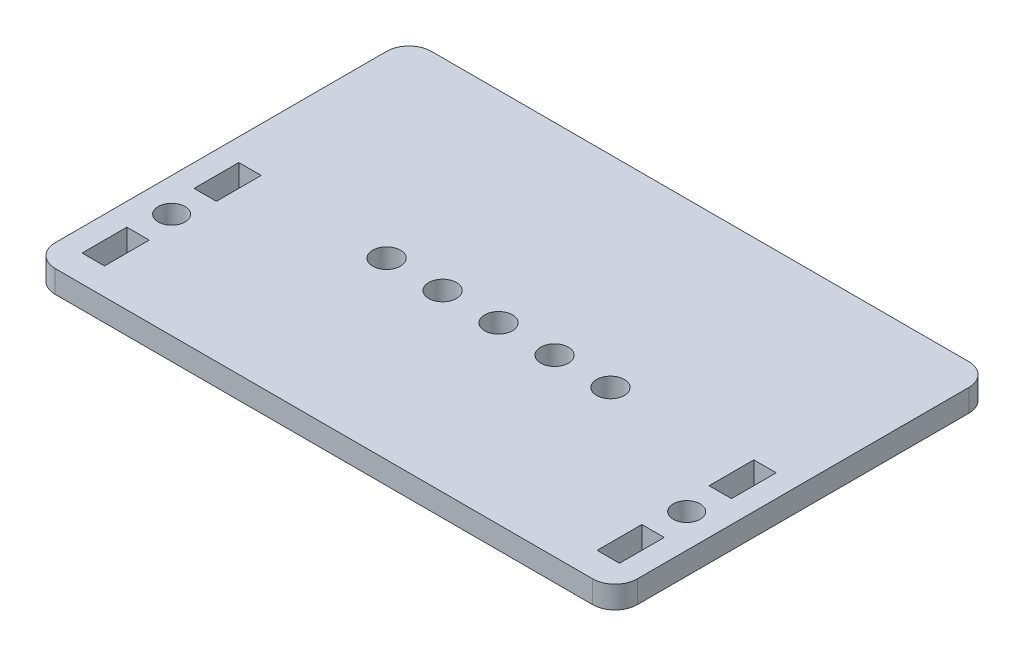
from build123d import *

# Parameters (mm, degrees)
SKETCH1_W           = 130
SKETCH1_H           = 52
BOSS_EXTRUDE1_DEPTH = 5
SKETCH2_W           = 130
SKETCH2_H           = 5
BOSS_EXTRUDE2_DEPTH = 32
SKETCH3_R           = 3
SKETCH3_W           = 5
SKETCH3_H           = 10
CUT_EXTRUDE1_DEPTH  = 10
FILLET1_R           = 5
CUT_EXTRUDE2_REACH  = 89.258
SKETCH4_R           = 3.1


with BuildPart() as part:
    # Sketch1 → Boss-Extrude1 (new body)
    with BuildSketch(Plane(origin=(0, 0, 0), x_dir=(1, 0, 0), z_dir=(0, 1, 0))):
        Rectangle(SKETCH1_W, SKETCH1_H)
    extrude(amount=BOSS_EXTRUDE1_DEPTH)

    # Sketch2 → Boss-Extrude2 (add)
    with BuildSketch(Plane(origin=(0, 0, -26), x_dir=(-1, 0, 0), z_dir=(0, 0, -1))):
        with Locations((0, 2.5)):
            Rectangle(SKETCH2_W, SKETCH2_H)
    extrude(amount=BOSS_EXTRUDE2_DEPTH)

    # Sketch3 → Cut-Extrude1 (cut)
    with BuildSketch(Plane(origin=(0, 5, 0), x_dir=(1, 0, 0), z_dir=(0, 1, 0))):
        with Locations(Location((-57.5, -2.5, 0), (0, 0, 270))):
            Circle(SKETCH3_R)
        with Locations(Location((57.5, -2.5, 0), (0, 0, 270))):
            Circle(SKETCH3_R)
        with Locations((57.5, 10)):
            Rectangle(SKETCH3_W, SKETCH3_H)
        with Locations((-57.5, -15)):
            Rectangle(SKETCH3_W, SKETCH3_H)
        with Locations((-57.5, 10)):
            Rectangle(SKETCH3_W, SKETCH3_H)
        with Locations((57.5, -15)):
            Rectangle(SKETCH3_W, SKETCH3_H)
    extrude(amount=-CUT_EXTRUDE1_DEPTH, mode=Mode.SUBTRACT)

    # Fillet1
    fillet1_edges = [part.edges().sort_by_distance(p)[0] for p in [
        (65, 2.5, -58),
        (-65, 2.5, -58),
        (65, 2.5, 26),
        (-65, 2.5, 26),
    ]]
    fillet(fillet1_edges, radius=FILLET1_R)

    # Sketch4 → Cut-Extrude2 (cut, up to next)
    with BuildSketch(Plane(origin=(0, 5, 0), x_dir=(1, 0, 0), z_dir=(0, 1, 0)), mode=Mode.PRIVATE) as cut_extrude2_sk1:
        with Locations(Location((-12.5, 13, 0), (0, 0, 270))):
            Circle(SKETCH4_R)
    cut_extrude2_tool1 = extrude(cut_extrude2_sk1.sketch, amount=-CUT_EXTRUDE2_REACH, mode=Mode.PRIVATE) & part.part
    # Sketch4 → Cut-Extrude2 (cut, up to next)
    with BuildSketch(Plane(origin=(0, 5, 0), x_dir=(1, 0, 0), z_dir=(0, 1, 0)), mode=Mode.PRIVATE) as cut_extrude2_sk2:
        with Locations(Location((-25, 13, 0), (0, 0, 270))):
            Circle(SKETCH4_R)
    cut_extrude2_tool2 = extrude(cut_extrude2_sk2.sketch, amount=-CUT_EXTRUDE2_REACH, mode=Mode.PRIVATE) & part.part
    # Sketch4 → Cut-Extrude2 (cut, up to next)
    with BuildSketch(Plane(origin=(0, 5, 0), x_dir=(1, 0, 0), z_dir=(0, 1, 0)), mode=Mode.PRIVATE) as cut_extrude2_sk3:
        with Locations(Location((0, 13, 0), (0, 0, 270))):
            Circle(SKETCH4_R)
    cut_extrude2_tool3 = extrude(cut_extrude2_sk3.sketch, amount=-CUT_EXTRUDE2_REACH, mode=Mode.PRIVATE) & part.part
    # Sketch4 → Cut-Extrude2 (cut, up to next)
    with BuildSketch(Plane(origin=(0, 5, 0), x_dir=(1, 0, 0), z_dir=(0, 1, 0)), mode=Mode.PRIVATE) as cut_extrude2_sk4:
        with Locations(Location((12.5, 13, 0), (0, 0, 270))):
            Circle(SKETCH4_R)
    cut_extrude2_tool4 = extrude(cut_extrude2_sk4.sketch, amount=-CUT_EXTRUDE2_REACH, mode=Mode.PRIVATE) & part.part
    # Sketch4 → Cut-Extrude2 (cut, up to next)
    with BuildSketch(Plane(origin=(0, 5, 0), x_dir=(1, 0, 0), z_dir=(0, 1, 0)), mode=Mode.PRIVATE) as cut_extrude2_sk5:
        with Locations(Location((25, 13, 0), (0, 0, 270))):
            Circle(SKETCH4_R)
    cut_extrude2_tool5 = extrude(cut_extrude2_sk5.sketch, amount=-CUT_EXTRUDE2_REACH, mode=Mode.PRIVATE) & part.part
    add(cut_extrude2_tool1.solids().sort_by_distance((-12.5, 5, -13))[0], mode=Mode.SUBTRACT)
    add(cut_extrude2_tool2.solids().sort_by_distance((-25, 5, -13))[0], mode=Mode.SUBTRACT)
    add(cut_extrude2_tool3.solids().sort_by_distance((0, 5, -13))[0], mode=Mode.SUBTRACT)
    add(cut_extrude2_tool4.solids().sort_by_distance((12.5, 5, -13))[0], mode=Mode.SUBTRACT)
    add(cut_extrude2_tool5.solids().sort_by_distance((25, 5, -13))[0], mode=Mode.SUBTRACT)


solid = part.part
